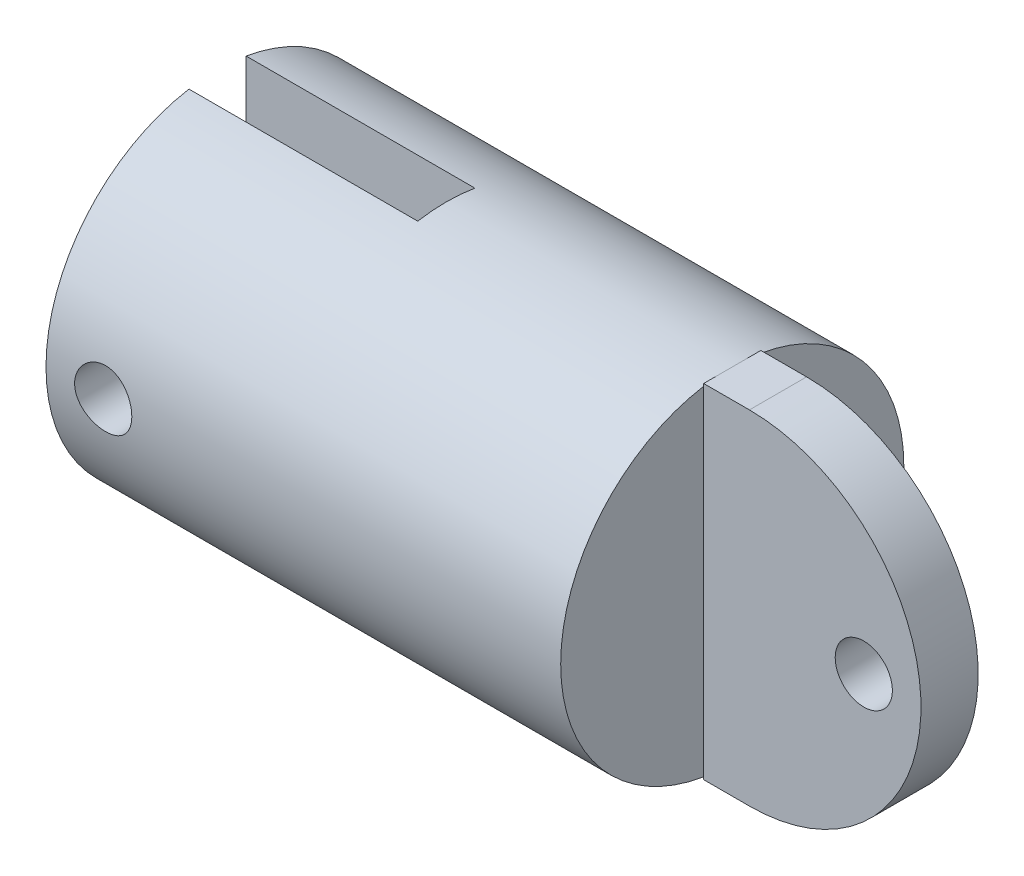
from build123d import *

# Parameters (mm, degrees)
SKETCH2_R               = 15
BOSS_EXTRUDE1_DEPTH     = 45
CUT_EXTRUDE1_DEPTH      = 50.749371855
CUT_EXTRUDE1_DEPTH_BACK = 50.749371855
SKETCH3_W               = 20
SKETCH3_H               = 5
CUT_EXTRUDE2_DEPTH      = 50.749371855
CUT_EXTRUDE2_DEPTH_BACK = 50.749371855
SKETCH6_R               = 2.5
SKETCH7_W               = 5
SKETCH7_H               = 30
BOSS_EXTRUDE2_DEPTH     = 4
BOSS_EXTRUDE3_DEPTH     = 5
CUT_EXTRUDE3_DEPTH      = 51.559371194
CUT_EXTRUDE3_DEPTH_BACK = 51.559371194
SKETCH9_R               = 2.5


with BuildPart() as part:
    # Sketch2 → Boss-Extrude1 (new body)
    with BuildSketch(Plane(origin=(0, 0, 0), x_dir=(0, 0, -1), z_dir=(1, 0, 0))):
        Circle(SKETCH2_R)
    extrude(amount=-BOSS_EXTRUDE1_DEPTH)

    # Sketch3 → Cut-Extrude1 (cut, two sides: drawn at the far end of the back side and taken through both)
    with BuildSketch(Plane(origin=(0, 0, 0), x_dir=(1, 0, 0), z_dir=(0, 1, 0)).offset(-CUT_EXTRUDE1_DEPTH_BACK)):
        with Locations((-35, 0)):
            Rectangle(SKETCH3_W, SKETCH3_H)
    extrude(amount=CUT_EXTRUDE1_DEPTH + CUT_EXTRUDE1_DEPTH_BACK, mode=Mode.SUBTRACT)

    # Sketch6 → Cut-Extrude2 (cut, two sides: drawn at the far end of the back side and taken through both)
    with BuildSketch(Plane.XY.offset(-CUT_EXTRUDE2_DEPTH_BACK)):
        with Locations((-40, 0)):
            Circle(SKETCH6_R)
    extrude(amount=CUT_EXTRUDE2_DEPTH + CUT_EXTRUDE2_DEPTH_BACK, mode=Mode.SUBTRACT)

    # Sketch7 → Boss-Extrude2 (add)
    with BuildSketch(Plane(origin=(0, 0, 0), x_dir=(0, 0, -1), z_dir=(1, 0, 0))):
        Rectangle(SKETCH7_W, SKETCH7_H)
    extrude(amount=BOSS_EXTRUDE2_DEPTH)

    # Sketch8 → Boss-Extrude3 (add)
    with BuildSketch(Plane.XY.offset(2.5)):
        with BuildLine():
            Line((4, 15), (4, -15))
            ThreePointArc((4, -15), (19, 0), (4, 15))
        make_face()
    extrude(amount=-BOSS_EXTRUDE3_DEPTH)

    # Sketch9 → Cut-Extrude3 (cut, two sides: drawn at the far end of the back side and taken through both)
    with BuildSketch(Plane.XY.offset(2.5).offset(-CUT_EXTRUDE3_DEPTH_BACK)):
        with Locations(Location((14, 0, 0), (0, 0, 270))):
            Circle(SKETCH9_R)
    extrude(amount=CUT_EXTRUDE3_DEPTH + CUT_EXTRUDE3_DEPTH_BACK, mode=Mode.SUBTRACT)


solid = part.part
